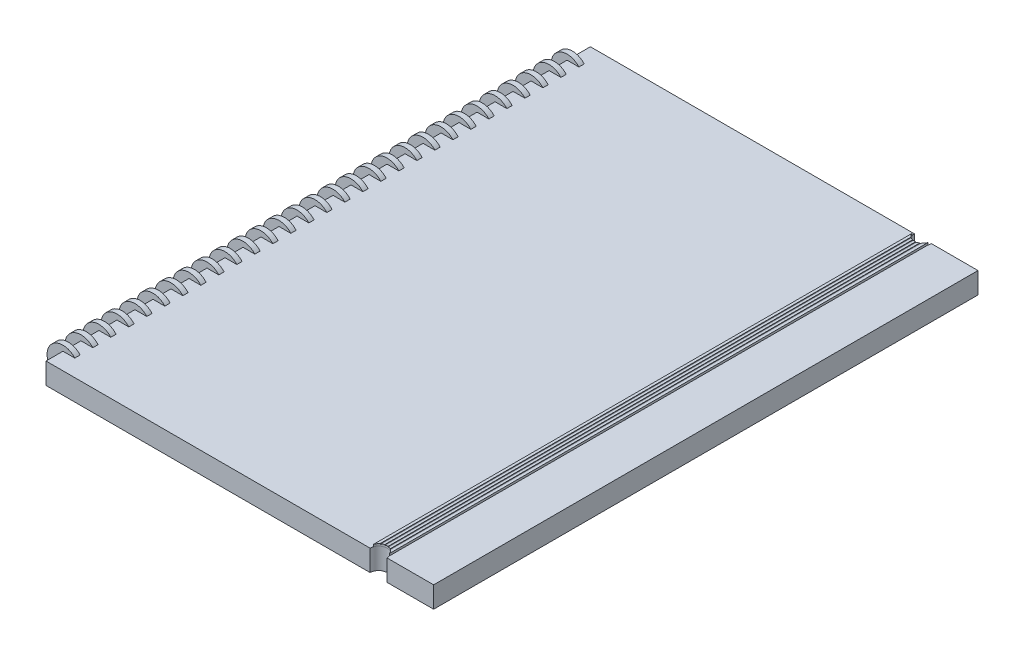
from build123d import *

# Parameters (mm, degrees)
SKETCH_1_W               = 183
SKETCH_1_H               = 257
EXTRUDE_1_DEPTH          = 10
EXTRUDE_START            = -8
SKETCH_2_R               = 7.5
EXTRUDE_2_DEPTH          = 2.5
PATTERN_LINEAR_1_COUNT   = 29
PATTERN_LINEAR_1_PITCH   = 8.5
SKETCH_3_W               = 7.5
SKETCH_3_H               = 257
EXTRUDE_3_DEPTH          = 1
SKETCH_4_W               = 0.5
SKETCH_4_H               = 0.4
CUT_EXTRUDE_1_DEPTH      = 257
CUT_EXTRUDE_2_DEPTH      = 50
CUT_EXTRUDE_2_DEPTH_BACK = 50
SKETCH_5_R               = 4
SKETCH_6_R               = 4
CUT_EXTRUDE_3_DEPTH      = 1
SKETCH_7_R               = 4
CUT_EXTRUDE_4_DEPTH      = 50


with BuildPart() as part:
    # 스케치1 → 보스-돌출1 (new body)
    with BuildSketch(Plane(origin=(0, 0, 0), x_dir=(1, 0, 0), z_dir=(0, 1, 0))):
        Rectangle(SKETCH_1_W, SKETCH_1_H)
    extrude(amount=EXTRUDE_1_DEPTH)

    # 스케치2 → 보스-돌출2 (add)
    with BuildSketch(Plane.XY.offset(128.5).offset(EXTRUDE_START)):
        with Locations((-91.5, 5)):
            Circle(SKETCH_2_R)
    extrude_2 = extrude(amount=-EXTRUDE_2_DEPTH)

    # 선형 패턴1: 보스-돌출2 ×29
    with Locations(*[(0, 0, -i * PATTERN_LINEAR_1_PITCH) for i in range(1, PATTERN_LINEAR_1_COUNT)]):
        add(extrude_2)

    # 스케치5 → 컷-돌출2 (cut, two sides: drawn at the far end of the back side and taken through both)
    with BuildSketch(Plane(origin=(0, 10, 0), x_dir=(1, 0, 0), z_dir=(0, 1, 0)).offset(-CUT_EXTRUDE_2_DEPTH_BACK)):
        with Locations((65.5, 128.5)):
            Circle(SKETCH_5_R)
    extrude(amount=CUT_EXTRUDE_2_DEPTH + CUT_EXTRUDE_2_DEPTH_BACK, mode=Mode.SUBTRACT)


with BuildPart() as body_2:
    # 스케치3 → 보스-돌출3 (new body)
    with BuildSketch(Plane(origin=(0, 10, 0), x_dir=(1, 0, 0), z_dir=(0, 1, 0))):
        with Locations((65.5, 0)):
            Rectangle(SKETCH_3_W, SKETCH_3_H)
    extrude(amount=EXTRUDE_3_DEPTH)

    # 스케치4 → 컷-돌출1 (cut)
    with BuildSketch(Plane.XY.offset(128.5)):
        with Locations((63.25, 11)):
            Rectangle(SKETCH_4_W, SKETCH_4_H)
        with Locations((64.75, 11)):
            Rectangle(SKETCH_4_W, SKETCH_4_H)
        with Locations((66.25, 11)):
            Rectangle(SKETCH_4_W, SKETCH_4_H)
        with Locations((67.75, 11)):
            Rectangle(SKETCH_4_W, SKETCH_4_H)
    extrude(amount=-CUT_EXTRUDE_1_DEPTH, mode=Mode.SUBTRACT)

    # 스케치6 → 컷-돌출3 (cut)
    with BuildSketch(Plane(origin=(0, 11, 0), x_dir=(1, 0, 0), z_dir=(0, 1, 0))):
        with Locations((65.5, 128.5)):
            Circle(SKETCH_6_R)
    extrude(amount=-CUT_EXTRUDE_3_DEPTH, mode=Mode.SUBTRACT)


with BuildPart() as cut_extrude_4_tool:
    # 스케치7 → 컷-돌출4 (new body)
    with BuildSketch(Plane(origin=(0, 11, 0), x_dir=(1, 0, 0), z_dir=(0, 1, 0))):
        with Locations((65.5, -128.5)):
            Circle(SKETCH_7_R)
    extrude(amount=-CUT_EXTRUDE_4_DEPTH)


with BuildPart() as part_1:
    add(part.part)

    # 컷-돌출4: cut by cut_extrude_4_tool
    add(cut_extrude_4_tool.part, mode=Mode.SUBTRACT)


with BuildPart() as body_2_1:
    add(body_2.part)

    # 컷-돌출4: cut by cut_extrude_4_tool
    add(cut_extrude_4_tool.part, mode=Mode.SUBTRACT)


solid = Compound([part_1.part, body_2_1.part])
